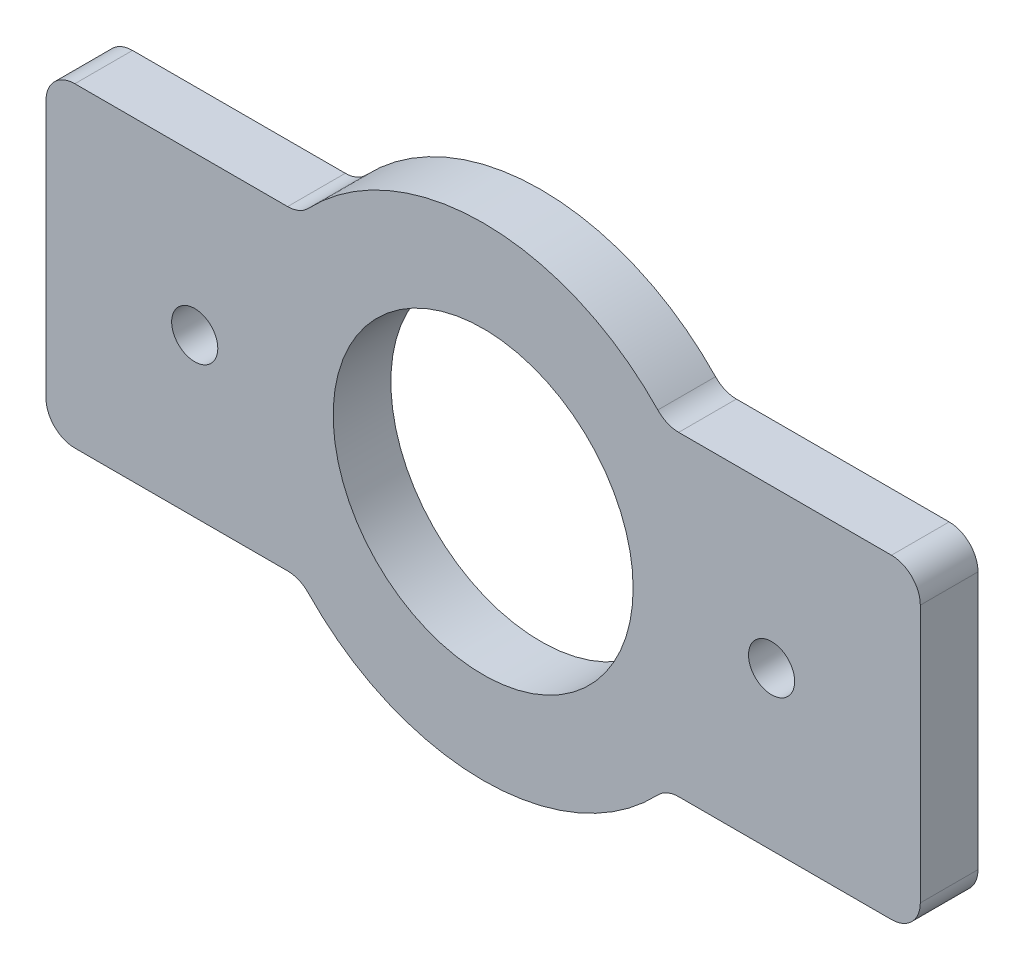
from build123d import *

# Parameters (mm, degrees)
SKETCH1_R           = 26
BOSS_EXTRUDE1_DEPTH = 10
FILLET1_R           = 5
SKETCH2_R           = 4
CUT_EXTRUDE1_DEPTH  = 10


with BuildPart() as part:
    # Sketch1 → Boss-Extrude1 (new body)
    with BuildSketch(Plane.XY):
        with BuildLine():
            Line((31.684802474, 27.352044719), (75.782561157, 27.352044719))
            Line((75.782561157, 27.352044719), (75.782561157, -27.352044719))
            Line((75.782561157, -27.352044719), (31.684802474, -27.352044719))
            ThreePointArc((31.684802474, -27.352044719), (0, -41.857628434), (-31.684802474, -27.352044719))
            Line((-31.684802474, -27.352044719), (-75.782561157, -27.352044719))
            Line((-75.782561157, -27.352044719), (-75.782561157, 27.352044719))
            Line((-75.782561157, 27.352044719), (-31.684802474, 27.352044719))
            ThreePointArc((-31.684802474, 27.352044719), (0, 41.857628434), (31.684802474, 27.352044719))
        make_face()
        Circle(SKETCH1_R, mode=Mode.SUBTRACT)
    extrude(amount=BOSS_EXTRUDE1_DEPTH)

    # Fillet1
    fillet1_edges = [part.edges().sort_by_distance(p)[0] for p in [
        (75.782561157, -27.352044719, 5),
        (31.684802474, -27.352044719, 5),
        (-31.684802474, -27.352044719, 5),
        (-75.782561157, -27.352044719, 5),
        (-75.782561157, 27.352044719, 5),
        (-31.684802474, 27.352044719, 5),
        (31.684802474, 27.352044719, 5),
        (75.782561157, 27.352044719, 5),
    ]]
    fillet(fillet1_edges, radius=FILLET1_R)

    # Sketch2 → Cut-Extrude1 (cut)
    with BuildSketch(Plane.XY.offset(10)):
        with Locations((-50, 0)):
            Circle(SKETCH2_R)
        with Locations((50, 0)):
            Circle(SKETCH2_R)
    extrude(amount=-CUT_EXTRUDE1_DEPTH, mode=Mode.SUBTRACT)


solid = part.part
